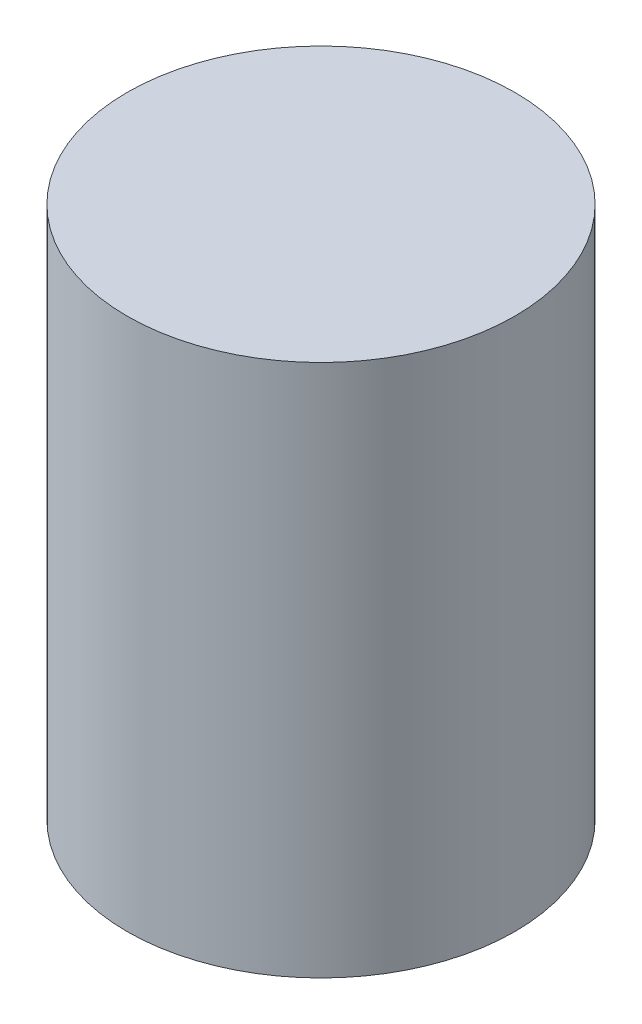
from build123d import *

# Parameters (mm, degrees)
SKETCH1_R           = 18
BOSS_EXTRUDE1_DEPTH = 49.5


with BuildPart() as part:
    # Sketch1 → Boss-Extrude1 (new body)
    with BuildSketch(Plane(origin=(0, 0, 0), x_dir=(1, 0, 0), z_dir=(0, 1, 0))):
        with Locations(Location((0, 0, 0), (0, 0, 270))):
            Circle(SKETCH1_R)
    extrude(amount=BOSS_EXTRUDE1_DEPTH)


solid = part.part
